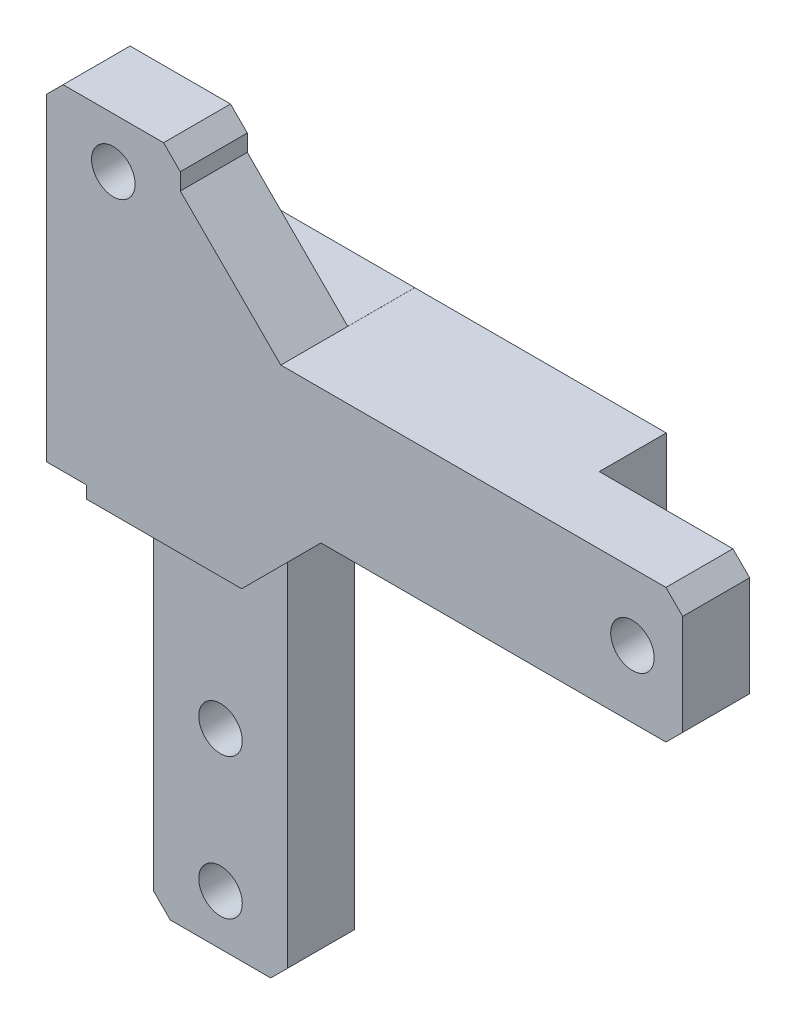
from build123d import *

# Parameters (mm, degrees)
SKETCH_1_R          = 0.65
EXTRUDE_1_DEPTH     = 4
CUT_EXTRUDE_START   = -2
SKETCH_2_W          = 4
SKETCH_2_H          = 11.631287185
SKETCH_2_R          = 0.65
CUT_EXTRUDE_1_DEPTH = 2
SKETCH_3_W          = 4.48994314
SKETCH_3_H          = 4
SKETCH_3_R          = 0.65
SKETCH_3_W_2        = 4
SKETCH_3_H_2        = 3.998874997
CUT_EXTRUDE_2_DEPTH = 2
CHAMFER_1_SIZE      = 3
CHAMFER_2_SIZE      = 0.5


with BuildPart() as part:
    # 草图1 → 凸台-拉伸1 (new body)
    with BuildSketch(Plane.XY):
        Polygon((-4.3, -2.5), (9.5, -2.5), (9.5, 1.5), (-5.5, 1.5), (-5.5, 5.5), (-9.5, 5.5), (-9.5, 1.5), (-9.5, -4.5), (-8.3, -4.5), (-8.3, -16.5), (-4.3, -16.5), align=None)
        with Locations((8, -0.5)):
            Circle(SKETCH_1_R, mode=Mode.SUBTRACT)
        with Locations((-7.5, 4)):
            Circle(SKETCH_1_R, mode=Mode.SUBTRACT)
        with Locations((-6.3, -15)):
            Circle(SKETCH_1_R, mode=Mode.SUBTRACT)
        with Locations((-6.3, -10.8)):
            Circle(SKETCH_1_R, mode=Mode.SUBTRACT)
    extrude(amount=EXTRUDE_1_DEPTH)

    # 草图2 → 切除-拉伸1 (cut)
    with BuildSketch(Plane.XY.offset(4).offset(CUT_EXTRUDE_START)):
        with Locations((-6.3, -10.684356408)):
            Rectangle(SKETCH_2_W, SKETCH_2_H)
        with Locations((-6.3, -15)):
            Circle(SKETCH_2_R, mode=Mode.SUBTRACT)
        with Locations((-6.3, -10.8)):
            Circle(SKETCH_2_R, mode=Mode.SUBTRACT)
    extrude(amount=CUT_EXTRUDE_1_DEPTH, mode=Mode.SUBTRACT)

    # 草图3 → 切除-拉伸2 (cut)
    # profile 1 of 2: a face of its own
    with BuildSketch(Plane(origin=(0, 0, 0), x_dir=(-1, 0, 0), z_dir=(0, 0, -1))):
        with Locations((-7.25502843, -0.5)):
            Rectangle(SKETCH_3_W, SKETCH_3_H)
        with Locations((-8, -0.5)):
            Circle(SKETCH_3_R, mode=Mode.SUBTRACT)
    # profile 2 of 2: a face of its own
    with BuildSketch(Plane(origin=(0, 0, 0), x_dir=(-1, 0, 0), z_dir=(0, 0, -1))):
        with Locations((7.5, 3.500562502)):
            Rectangle(SKETCH_3_W_2, SKETCH_3_H_2)
        with Locations((7.5, 4)):
            Circle(SKETCH_3_R, mode=Mode.SUBTRACT)
    extrude(amount=-CUT_EXTRUDE_2_DEPTH, mode=Mode.SUBTRACT)

    # 倒角1
    chamfer_1_edges = [part.edges().sort_by_distance(p)[0] for p in [
        (-4.3, -2.5, 2),
        (-5.5, 1.5, 2),
    ]]
    chamfer(chamfer_1_edges, length=CHAMFER_1_SIZE)

    # 倒角2
    chamfer_2_edges = [part.edges().sort_by_distance(p)[0] for p in [
        (9.5, -2.5, 3),
        (-9.5, 5.5, 3),
        (-5.5, 5.5, 3),
        (9.5, 1.5, 3),
        (-4.3, -16.5, 1),
        (-8.3, -16.5, 1),
    ]]
    chamfer(chamfer_2_edges, length=CHAMFER_2_SIZE)


solid = part.part
